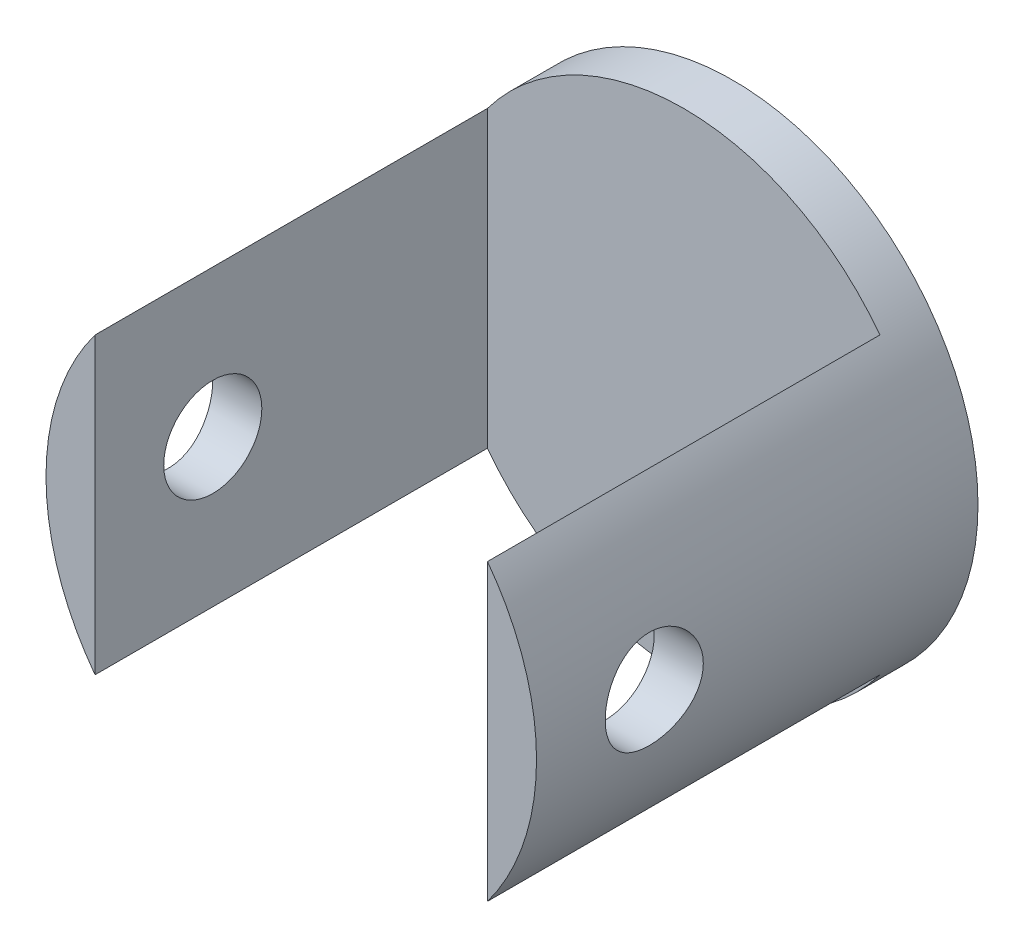
from build123d import *

# Parameters (mm, degrees)
SKETCH1_R               = 25
BOSS_EXTRUDE1_DEPTH     = 45
CUT_EXTRUDE1_START      = -40
CUT_EXTRUDE1_DEPTH      = 40
SKETCH3_R               = 5
BOSS_EXTRUDE2_DEPTH     = 2
CUT_EXTRUDE2_DEPTH      = 69.373971656
CUT_EXTRUDE2_DEPTH_BACK = 69.373971656
SKETCH4_R               = 5


with BuildPart() as part:
    # Sketch1 → Boss-Extrude1 (new body)
    with BuildSketch(Plane.XY):
        with Locations(Location((0, 0, 0), (0, 0, 180))):
            Circle(SKETCH1_R)
    extrude(amount=BOSS_EXTRUDE1_DEPTH)

    # Sketch2 → Cut-Extrude1 (cut)
    with BuildSketch(Plane.XY.offset(45).offset(CUT_EXTRUDE1_START)):
        with BuildLine():
            Line((-20, 15), (-20, -15))
            ThreePointArc((-20, -15), (0, -25), (20, -15))
            Line((20, -15), (20, 15))
            ThreePointArc((20, 15), (0, 25), (-20, 15))
        make_face()
    extrude(amount=CUT_EXTRUDE1_DEPTH, mode=Mode.SUBTRACT)

    # Sketch3 → Boss-Extrude2 (add)
    with BuildSketch(Plane(origin=(0, 0, 0), x_dir=(-1, 0, 0), z_dir=(0, 0, -1))):
        with Locations(Location((6.33, 7.66, 0), (0, 0, 180))):
            Circle(SKETCH3_R)
        with Locations(Location((-6.33, -7.66, 0), (0, 0, 180))):
            Circle(SKETCH3_R)
    extrude(amount=BOSS_EXTRUDE2_DEPTH)

    # Sketch4 → Cut-Extrude2 (cut, two sides: drawn at the far end of the back side and taken through both)
    with BuildSketch(Plane(origin=(-20, 0, 0), x_dir=(0, 0, -1), z_dir=(1, 0, 0)).offset(-CUT_EXTRUDE2_DEPTH_BACK)):
        with Locations((-33, 0)):
            Circle(SKETCH4_R)
    extrude(amount=CUT_EXTRUDE2_DEPTH + CUT_EXTRUDE2_DEPTH_BACK, mode=Mode.SUBTRACT)


solid = part.part
